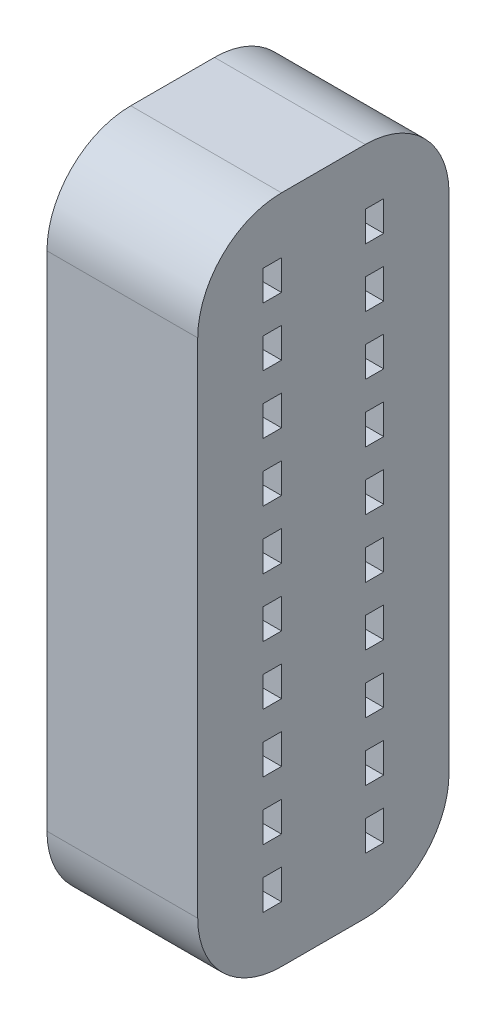
from build123d import *

# Parameters (mm, degrees)
BOSS_EXTRUDE1_DEPTH = 9
SKETCH2_W           = 1.8
SKETCH2_H           = 1.1
CUT_EXTRUDE1_DEPTH  = 24.178653973
SKETCH3_W           = 1.8
SKETCH3_H           = 1.1
CUT_EXTRUDE2_DEPTH  = 7


with BuildPart() as part:
    # Sketch1 → Boss-Extrude1 (new body)
    with BuildSketch(Plane.YZ):
        with BuildLine():
            Line((-15, -7.5), (15, -7.5))
            ThreePointArc((15, -7.5), (18.535533906, -6.035533906), (20, -2.5))
            Line((20, -2.5), (20, 2.5))
            ThreePointArc((20, 2.5), (18.535533906, 6.035533906), (15, 7.5))
            Line((15, 7.5), (-15, 7.5))
            ThreePointArc((-15, 7.5), (-18.535533906, 6.035533906), (-20, 2.5))
            Line((-20, 2.5), (-20, -2.5))
            ThreePointArc((-20, -2.5), (-18.535533906, -6.035533906), (-15, -7.5))
        make_face()
    extrude(amount=BOSS_EXTRUDE1_DEPTH)

    # Sketch2 → Cut-Extrude1 (cut, through all)
    with BuildSketch(Plane.YZ.offset(9)):
        with Locations((-12.25, 3.05)):
            Rectangle(SKETCH2_W, SKETCH2_H)
        with Locations((-15.75, 3.05)):
            Rectangle(SKETCH2_W, SKETCH2_H)
        with Locations((-8.75, 3.05)):
            Rectangle(SKETCH2_W, SKETCH2_H)
        with Locations((-5.25, 3.05)):
            Rectangle(SKETCH2_W, SKETCH2_H)
        with Locations((-1.75, 3.05)):
            Rectangle(SKETCH2_W, SKETCH2_H)
        with Locations((1.75, 3.05)):
            Rectangle(SKETCH2_W, SKETCH2_H)
        with Locations((5.25, 3.05)):
            Rectangle(SKETCH2_W, SKETCH2_H)
        with Locations((8.75, 3.05)):
            Rectangle(SKETCH2_W, SKETCH2_H)
        with Locations((12.25, 3.05)):
            Rectangle(SKETCH2_W, SKETCH2_H)
        with Locations((15.75, 3.05)):
            Rectangle(SKETCH2_W, SKETCH2_H)
        with Locations((-12.25, -3.05)):
            Rectangle(SKETCH2_W, SKETCH2_H)
        with Locations((-8.75, -3.05)):
            Rectangle(SKETCH2_W, SKETCH2_H)
        with Locations((-5.25, -3.05)):
            Rectangle(SKETCH2_W, SKETCH2_H)
        with Locations((-1.75, -3.05)):
            Rectangle(SKETCH2_W, SKETCH2_H)
        with Locations((1.75, -3.05)):
            Rectangle(SKETCH2_W, SKETCH2_H)
        with Locations((5.25, -3.05)):
            Rectangle(SKETCH2_W, SKETCH2_H)
        with Locations((8.75, -3.05)):
            Rectangle(SKETCH2_W, SKETCH2_H)
        with Locations((12.25, -3.05)):
            Rectangle(SKETCH2_W, SKETCH2_H)
        with Locations((15.75, -3.05)):
            Rectangle(SKETCH2_W, SKETCH2_H)
        with Locations((-15.75, -3.05)):
            Rectangle(SKETCH2_W, SKETCH2_H)
    extrude(amount=-CUT_EXTRUDE1_DEPTH, mode=Mode.SUBTRACT)

    # Sketch3 → Cut-Extrude2 (cut)
    with BuildSketch(Plane(origin=(0, 0, 0), x_dir=(0, -1, 0), z_dir=(-1, 0, 0))):
        with Locations((-15.75, 1.95)):
            Rectangle(SKETCH3_W, SKETCH3_H)
        with Locations((-12.25, 1.95)):
            Rectangle(SKETCH3_W, SKETCH3_H)
        with Locations((-8.75, 1.95)):
            Rectangle(SKETCH3_W, SKETCH3_H)
        with Locations((-5.25, 1.95)):
            Rectangle(SKETCH3_W, SKETCH3_H)
        with Locations((-1.75, 1.95)):
            Rectangle(SKETCH3_W, SKETCH3_H)
        with Locations((1.75, 1.95)):
            Rectangle(SKETCH3_W, SKETCH3_H)
        with Locations((5.25, 1.95)):
            Rectangle(SKETCH3_W, SKETCH3_H)
        with Locations((8.75, 1.95)):
            Rectangle(SKETCH3_W, SKETCH3_H)
        with Locations((12.25, 1.95)):
            Rectangle(SKETCH3_W, SKETCH3_H)
        with Locations((15.75, 1.95)):
            Rectangle(SKETCH3_W, SKETCH3_H)
        with Locations((-15.75, -4.15)):
            Rectangle(SKETCH3_W, SKETCH3_H)
        with Locations((-12.25, -4.15)):
            Rectangle(SKETCH3_W, SKETCH3_H)
        with Locations((-8.75, -4.15)):
            Rectangle(SKETCH3_W, SKETCH3_H)
        with Locations((-5.25, -4.15)):
            Rectangle(SKETCH3_W, SKETCH3_H)
        with Locations((-1.75, -4.15)):
            Rectangle(SKETCH3_W, SKETCH3_H)
        with Locations((1.75, -4.15)):
            Rectangle(SKETCH3_W, SKETCH3_H)
        with Locations((5.25, -4.15)):
            Rectangle(SKETCH3_W, SKETCH3_H)
        with Locations((8.75, -4.15)):
            Rectangle(SKETCH3_W, SKETCH3_H)
        with Locations((12.25, -4.15)):
            Rectangle(SKETCH3_W, SKETCH3_H)
        with Locations((15.75, -4.15)):
            Rectangle(SKETCH3_W, SKETCH3_H)
    extrude(amount=-CUT_EXTRUDE2_DEPTH, mode=Mode.SUBTRACT)


solid = part.part
